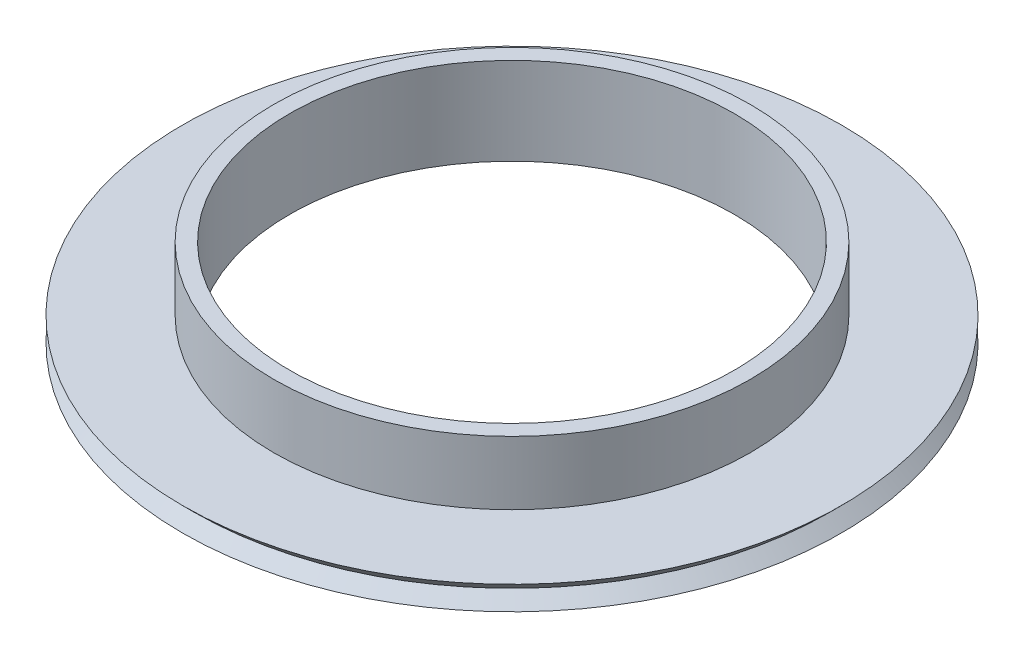
from build123d import *


with BuildPart() as part:
    # Sketch1 → Revolve1 (revolve)
    with BuildSketch(Plane.XY, mode=Mode.PRIVATE) as revolve1_sk:
        Polygon((-28, 11), (-28, 0), (-41.5, 0), (-40, 1.5), (-41.5, 3), (-30, 3), (-30, 11), align=None)
    revolve(revolve1_sk.sketch.rotate(Axis((0, 0, 0), (0, 1, 0)), 270), axis=Axis((0, 0, 0), (0, 1, 0)))


solid = part.part
